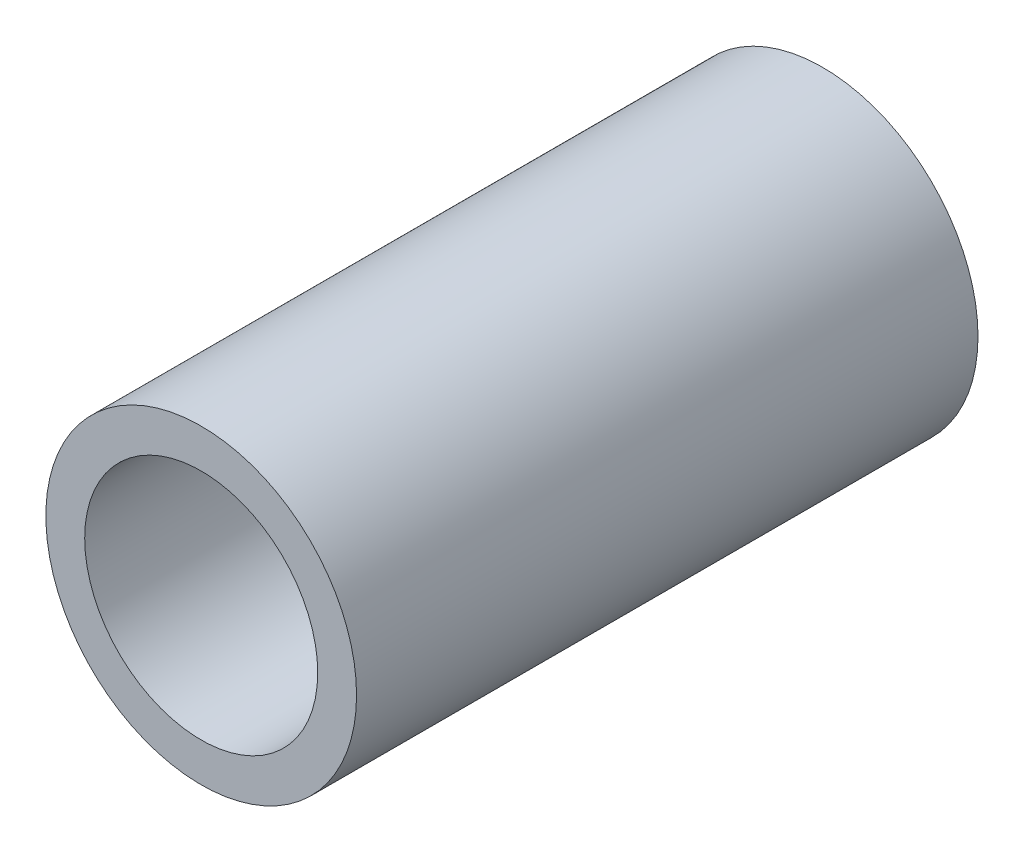
from build123d import *

# Parameters (mm, degrees)
SKETCH1_R           = 6.35
SKETCH1_R_2         = 4.7625
BOSS_EXTRUDE1_DEPTH = 25.4


with BuildPart() as part:
    # Sketch1 → Boss-Extrude1 (new body)
    with BuildSketch(Plane.XY):
        Circle(SKETCH1_R)
        Circle(SKETCH1_R_2, mode=Mode.SUBTRACT)
    extrude(amount=BOSS_EXTRUDE1_DEPTH)


solid = part.part
